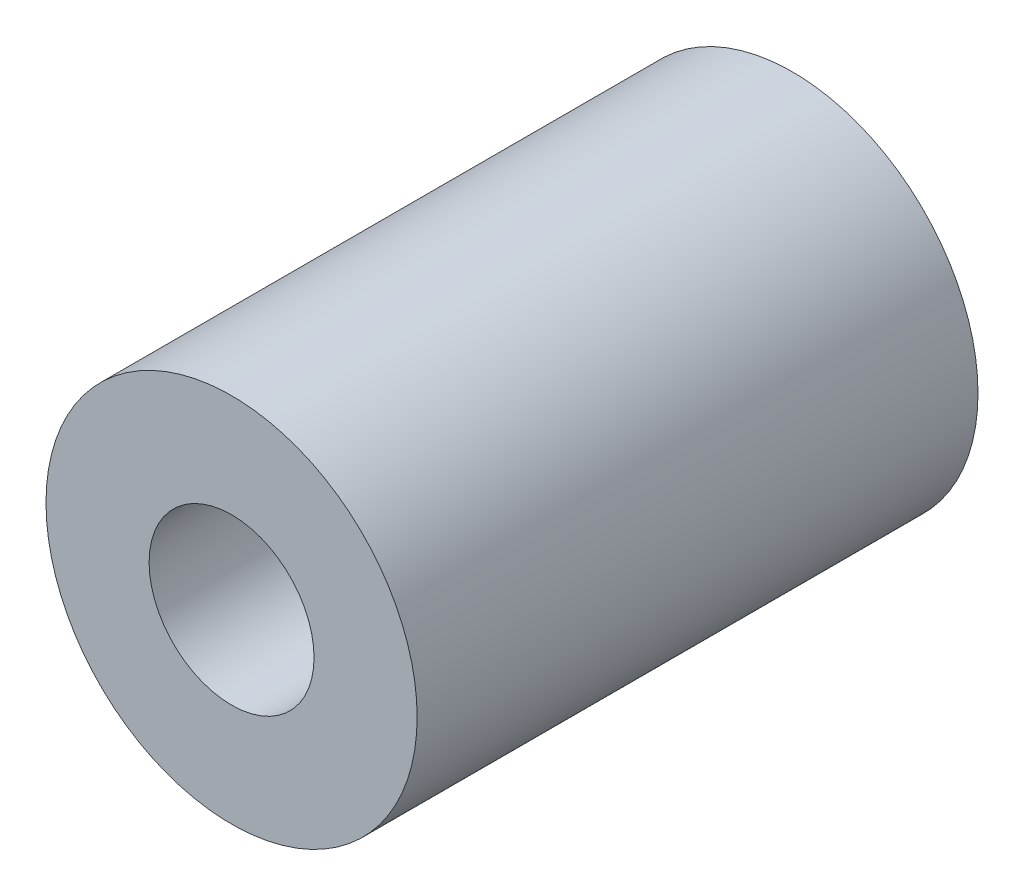
from build123d import *

# Parameters (mm, degrees)
CROQUIS1_R              = 2.25
CROQUIS1_R_2            = 1
SALIENTE_EXTRUIR1_DEPTH = 6.8


with BuildPart() as part:
    # Croquis1 → Saliente-Extruir1 (new body)
    with BuildSketch(Plane.XY):
        Circle(CROQUIS1_R)
        Circle(CROQUIS1_R_2, mode=Mode.SUBTRACT)
    extrude(amount=SALIENTE_EXTRUIR1_DEPTH)


solid = part.part
